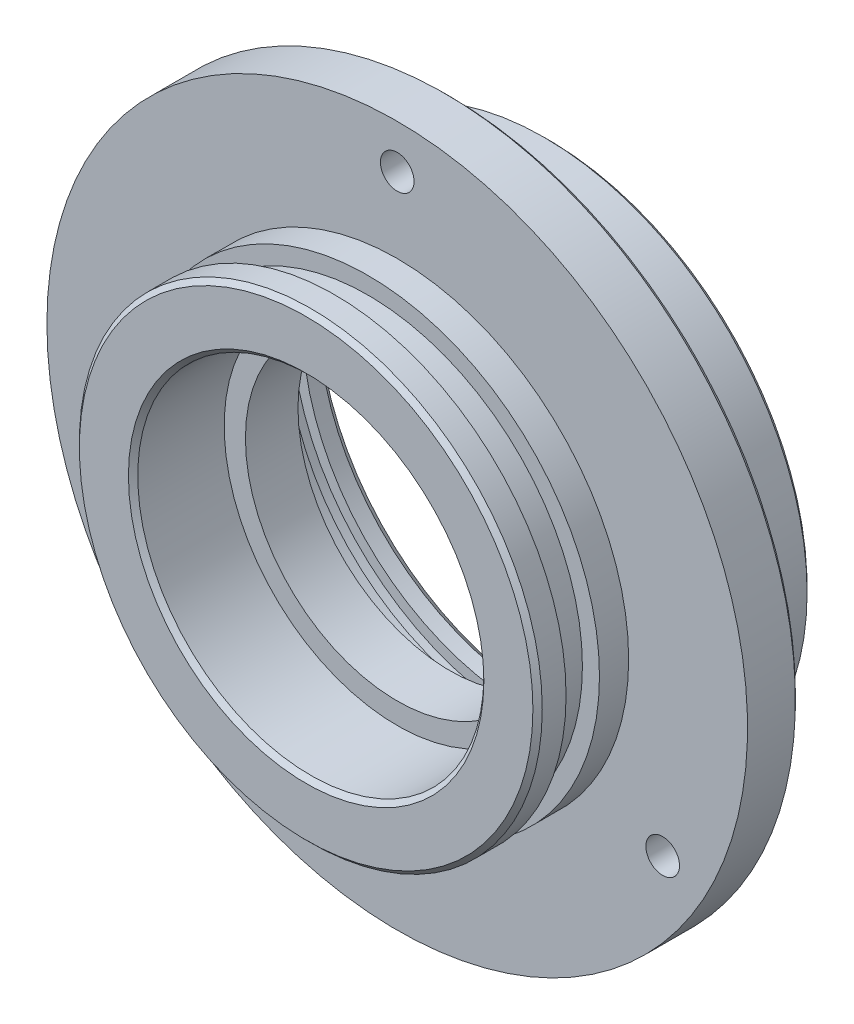
from build123d import *

# Parameters (mm, degrees)
SKETCH1_R             = 25.1714
SKETCH1_R_2           = 18.8214
BOSS_EXTRUDE1_DEPTH   = 9.906
SKETCH2_R             = 28.575
BOSS_EXTRUDE2_DEPTH   = 5.08
CUT_EXTRUDE1_START    = 3.6322
SKETCH3_R             = 25.1714
SKETCH3_R_2           = 23.3172
CUT_EXTRUDE1_DEPTH    = 3.6322
SKETCH5_W             = 1.778
SKETCH5_H             = 12.5603
SKETCH6_R             = 16.51
CUT_EXTRUDE2_DEPTH    = 44.100364801
SKETCH10_W            = 1.8796
SKETCH10_H            = 3.5052
BOSS_EXTRUDE3_START   = -5.715
SKETCH7_R             = 38.1
SKETCH7_R_2           = 28.575
BOSS_EXTRUDE3_DEPTH   = 5.715
F_6_CLEARANCE_HOLE1_D = 3.6576
CIRPATTERN1_COUNT     = 3
CHAMFER1_SIZE         = 0.508
CHAMFER3_SIZE         = 1.016


with BuildPart() as part:
    # Sketch1 → Boss-Extrude1 (new body)
    with BuildSketch(Plane.XY):
        Circle(SKETCH1_R)
        Circle(SKETCH1_R_2, mode=Mode.SUBTRACT)
    extrude(amount=-BOSS_EXTRUDE1_DEPTH)

    # Sketch2 → Boss-Extrude2 (add)
    with BuildSketch(Plane(origin=(0, 0, -9.906), x_dir=(-1, 0, 0), z_dir=(0, 0, -1))):
        Circle(SKETCH2_R)
    extrude(amount=BOSS_EXTRUDE2_DEPTH)

    # Sketch3 → Cut-Extrude1 (cut)
    with BuildSketch(Plane.XY.offset(-6.731).offset(CUT_EXTRUDE1_START)):
        Circle(SKETCH3_R)
        Circle(SKETCH3_R_2, mode=Mode.SUBTRACT)
    extrude(amount=-CUT_EXTRUDE1_DEPTH, mode=Mode.SUBTRACT)

    # Sketch4 → Revolve1 (revolve)
    with BuildSketch(Plane(origin=(0, 0, 0), x_dir=(0, 0, -1), z_dir=(1, 0, 0)), mode=Mode.PRIVATE) as revolve1_sk:
        Polygon((9.906, 16.51), (9.906, 28.575), (26.416, 28.575), (26.416, 24.0665), (15.621, 24.0665), (15.621, 16.51), align=None)
    revolve(revolve1_sk.sketch.rotate(Axis((0, 0, -23.632862863), (0, 0, 1)), 90), axis=Axis((0, 0, -23.632862863), (0, 0, 1)))

    # Sketch5 → Cut-Revolve1 (revolve, cut)
    with BuildSketch(Plane(origin=(0, 0, 0), x_dir=(0, 0, -1), z_dir=(1, 0, 0)), mode=Mode.PRIVATE) as cut_revolve1_sk:
        with Locations((22.7838, 18.98015)):
            Rectangle(SKETCH5_W, SKETCH5_H)
    revolve(cut_revolve1_sk.sketch.rotate(Axis((0, 0, -23.632862863), (0, 0, 1)), 90), axis=Axis((0, 0, -23.632862863), (0, 0, 1)), mode=Mode.SUBTRACT)

    # Sketch6 → Cut-Extrude2 (cut, through all)
    with BuildSketch(Plane(origin=(0, 0, -14.986), x_dir=(-1, 0, 0), z_dir=(0, 0, -1))):
        Circle(SKETCH6_R)
    extrude(amount=-CUT_EXTRUDE2_DEPTH, mode=Mode.SUBTRACT)

    # Sketch10 → Cut-Revolve2 (revolve, cut)
    with BuildSketch(Plane(origin=(0, 0, 0), x_dir=(0, 0, -1), z_dir=(1, 0, 0)), mode=Mode.PRIVATE) as cut_revolve2_sk:
        with Locations((14.6812, 21.4249)):
            Rectangle(SKETCH10_W, SKETCH10_H)
    revolve(cut_revolve2_sk.sketch.rotate(Axis((0, 0, 0), (0, 0, -1)), 90), axis=Axis((0, 0, 0), (0, 0, -1)), mode=Mode.SUBTRACT)

    # Sketch7 → Boss-Extrude3 (add)
    with BuildSketch(Plane(origin=(0, 0, -15.621), x_dir=(-1, 0, 0), z_dir=(0, 0, -1)).offset(BOSS_EXTRUDE3_START)):
        Circle(SKETCH7_R)
        Circle(SKETCH7_R_2, mode=Mode.SUBTRACT)
    extrude(amount=BOSS_EXTRUDE3_DEPTH)

    # #6 Clearance Hole1 (through all)
    with Locations(Plane(origin=(12.683965444, 15.420187154, -15.621), x_dir=(-1, 0, 0), z_dir=(0, 0, -1))):
        with Locations((12.683965444, 17.917312846)):
            f_6_clearance_hole1 = Hole(F_6_CLEARANCE_HOLE1_D / 2)

    # CirPattern1: #6 Clearance Hole1 ×3 about axis
    cirpattern1_axis = Axis((0, 0, 0), (0, 0, 1))
    for i in range(1, CIRPATTERN1_COUNT):
        add(f_6_clearance_hole1.rotate(cirpattern1_axis, i * 360 / CIRPATTERN1_COUNT), mode=Mode.SUBTRACT)

    # Chamfer1
    chamfer1_edges = [part.edges().sort_by_distance(p)[0] for p in [
        (-25.1714, 0, 0),
        (28.575, 0, -26.416),
        (38.1, 0, -15.621),
        (-18.8214, 0, 0),
    ]]
    chamfer(chamfer1_edges, length=CHAMFER1_SIZE)

    # Chamfer3
    chamfer3_edges = [part.edges().sort_by_distance(p)[0] for p in [
        (24.0665, 0, -26.416),
    ]]
    chamfer(chamfer3_edges, length=CHAMFER3_SIZE)


solid = part.part
